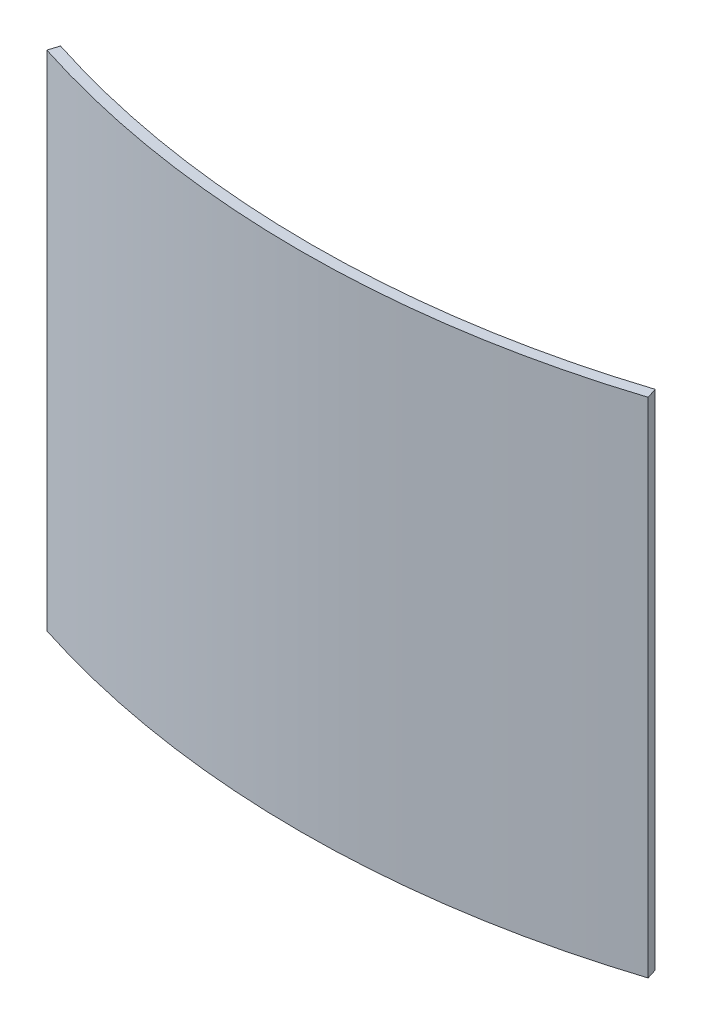
from build123d import *

# Parameters (mm, degrees)
EXTRUS_O_FINA1_DEPTH      = 230
EXTRUS_O_FINA1_DEPTH_BACK = 230


with BuildPart() as part:
    # Esboço1 → Extrusão-Fina1 (new, two sides: drawn at the far end of the back side and taken through both)
    with BuildSketch(Plane(origin=(0, 0, 0), x_dir=(1, 0, 0), z_dir=(0, 1, 0)).offset(-EXTRUS_O_FINA1_DEPTH_BACK)):
        with BuildLine():
            ThreePointArc((275, 0), (0, -43.04317495), (-275, 0))
            Line((-275, 0), (-271.944444444, 9.521742501))
            ThreePointArc((-271.944444444, 9.521742501), (0, -33.04317495), (271.944444444, 9.521742501))
            Line((271.944444444, 9.521742501), (275, 0))
        make_face()
    extrude(amount=EXTRUS_O_FINA1_DEPTH + EXTRUS_O_FINA1_DEPTH_BACK)


solid = part.part
